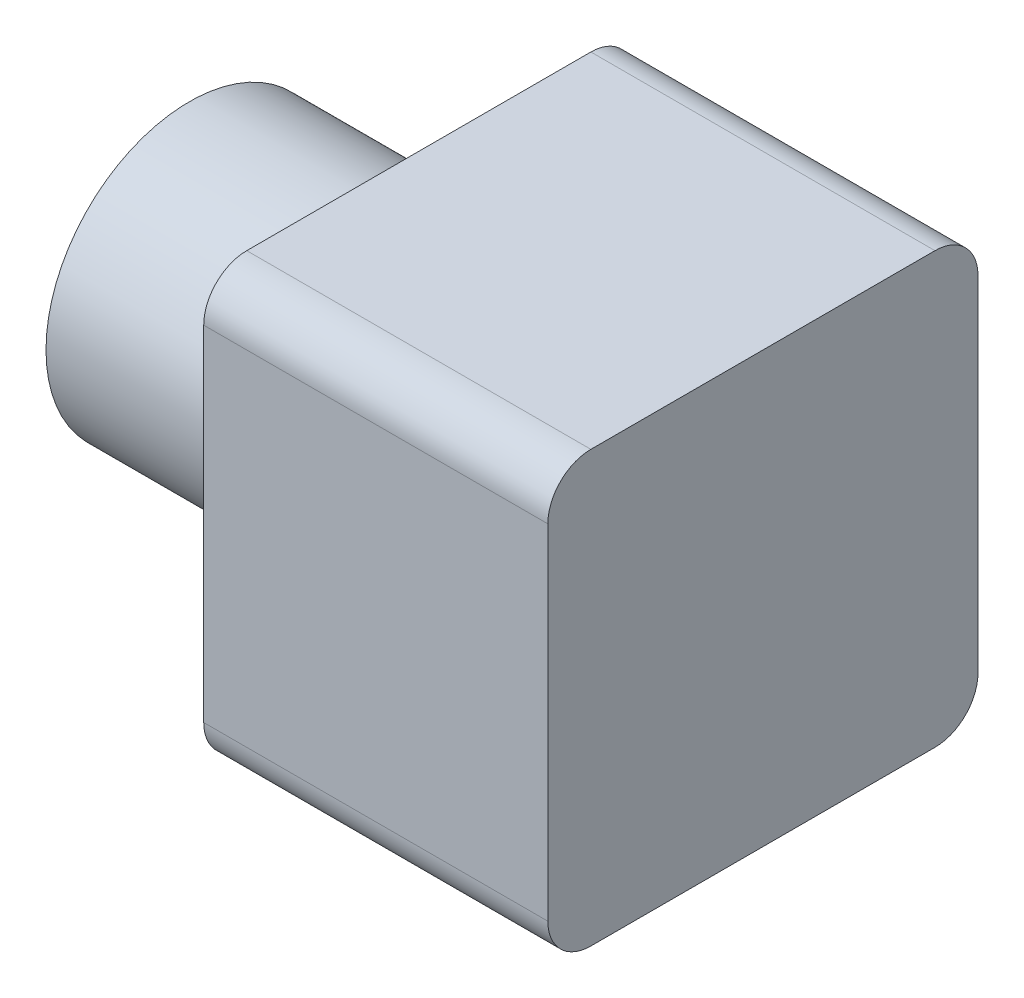
from build123d import *

# Parameters (mm, degrees)
SKETCH2_R           = 5
BOSS_EXTRUDE1_DEPTH = 8
SKETCH3_W           = 15
SKETCH3_H           = 15
BOSS_EXTRUDE2_DEPTH = 12
SKETCH4_R           = 4
CUT_EXTRUDE1_DEPTH  = 1
FILLET1_R           = 1.5


with BuildPart() as part:
    # Sketch2 → Boss-Extrude1 (new body)
    with BuildSketch(Plane.ZY.offset(36.137829577)):
        with Locations((-25, -31.600577771)):
            Circle(SKETCH2_R)
    extrude(amount=BOSS_EXTRUDE1_DEPTH)

    # Sketch3 → Boss-Extrude2 (add)
    with BuildSketch(Plane(origin=(-36.137829577, 0, 0), x_dir=(0, 0, -1), z_dir=(1, 0, 0))):
        with Locations((25, -31.600577771)):
            Rectangle(SKETCH3_W, SKETCH3_H)
    extrude(amount=BOSS_EXTRUDE2_DEPTH)

    # Sketch4 → Cut-Extrude1 (cut)
    with BuildSketch(Plane.ZY.offset(44.137829577)):
        with Locations((-25, -31.600577771)):
            Circle(SKETCH4_R)
    extrude(amount=-CUT_EXTRUDE1_DEPTH, mode=Mode.SUBTRACT)

    # Fillet1
    fillet1_edges = [part.edges().sort_by_distance(p)[0] for p in [
        (-30.137829577, -24.100577771, -17.5),
        (-30.137829577, -24.100577771, -32.5),
        (-30.137829577, -39.100577771, -17.5),
        (-30.137829577, -39.100577771, -32.5),
    ]]
    fillet(fillet1_edges, radius=FILLET1_R)


solid = part.part
